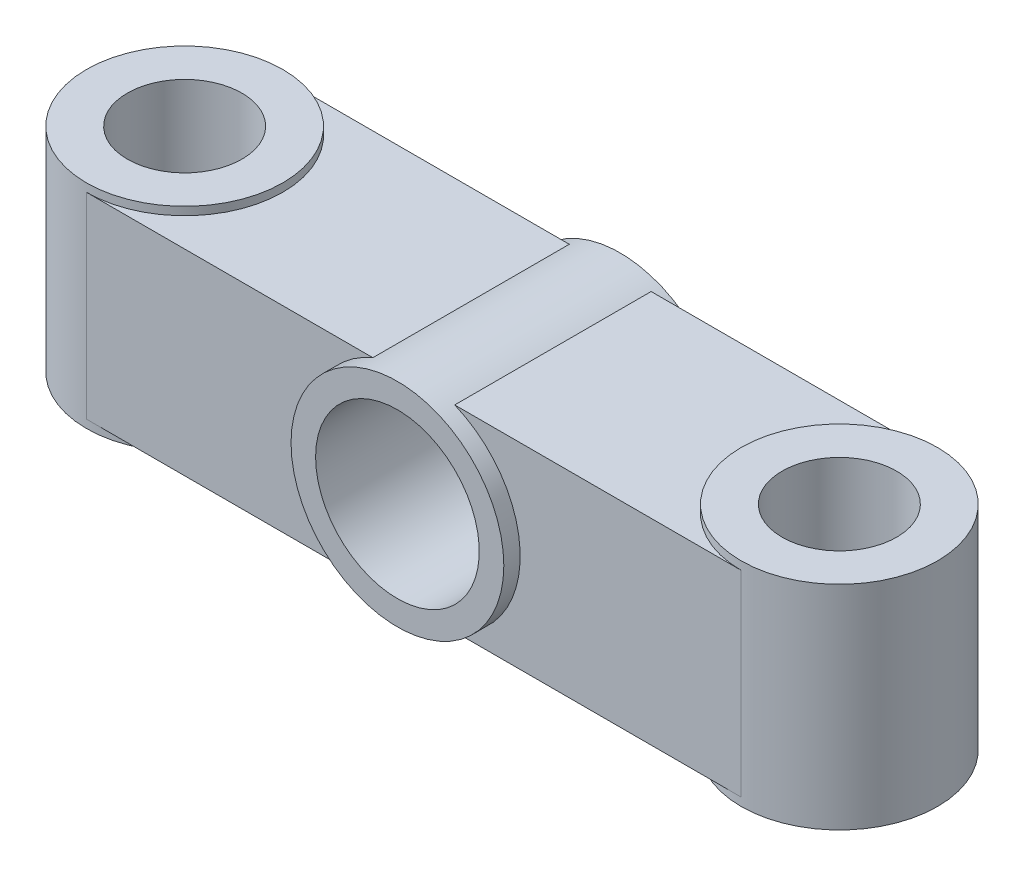
from build123d import *
from build123d.topology import SkipClean

# Parameters (mm, degrees)
EXTRUDE_1_DEPTH     = 3
SKETCH_2_R          = 3
EXTRUDE_2_DEPTH     = 3.25
SKETCH_3_R          = 1.75
CUT_EXTRUDE_3_DEPTH = 6.5
SKETCH_4_R          = 3.25
EXTRUDE_5_DEPTH     = 6.5
EXTRUDE_START       = 0.3
SKETCH_6_R          = 3.25
EXTRUDE_6_DEPTH     = 0.3
SKETCH_7_R          = 2.5
CUT_EXTRUDE_7_DEPTH = 16.02672619


with BuildPart() as part:
    # 草图1 → 拉伸1 (new, symmetric)
    with BuildSketch(Plane(origin=(0, 0, 0), x_dir=(1, 0, 0), z_dir=(0, 1, 0))):
        with BuildLine():
            Line((-10, -3), (10, -3))
            ThreePointArc((10, -3), (13, 0), (10, 3))
            Line((10, 3), (-10, 3))
            ThreePointArc((-10, 3), (-13, 0), (-10, -3))
        make_face()
    extrude(amount=EXTRUDE_1_DEPTH, both=True)

    # 草图2 → 拉伸2 (add, symmetric)
    with SkipClean():  # the faces are left unmerged after this step: merging them gives an invalid solid
        with BuildSketch(Plane(origin=(0, 0, 0), x_dir=(1, 0, 0), z_dir=(0, 1, 0))):
            with Locations(Location((10, 0, 0), (0, 0, 270))):
                Circle(SKETCH_2_R)
            with Locations(Location((-10, 0, 0), (0, 0, 270))):
                Circle(SKETCH_2_R)
        extrude(amount=EXTRUDE_2_DEPTH, both=True)

    # 草图3 → 拉伸3 (cut)
    with SkipClean():  # the faces are left unmerged after this step: merging them gives an invalid solid
        with BuildSketch(Plane(origin=(0, 3.25, 0), x_dir=(1, 0, 0), z_dir=(0, 1, 0))):
            with Locations(Location((-10, 0, 0), (0, 0, 270))):
                Circle(SKETCH_3_R)
            with Locations(Location((10, 0, 0), (0, 0, 270))):
                Circle(SKETCH_3_R)
        extrude(amount=-CUT_EXTRUDE_3_DEPTH, mode=Mode.SUBTRACT)

    # 草图4 → 拉伸5 (add)
    with SkipClean():  # the faces are left unmerged after this step: merging them gives an invalid solid
        with BuildSketch(Plane(origin=(0, 0, -3), x_dir=(-1, 0, 0), z_dir=(0, 0, -1))):
            Circle(SKETCH_4_R)
        extrude(amount=-EXTRUDE_5_DEPTH)

    # 草图6 → 拉伸6 (add)
    with SkipClean():  # the faces are left unmerged after this step: merging them gives an invalid solid
        with BuildSketch(Plane(origin=(0, 0, -3), x_dir=(-1, 0, 0), z_dir=(0, 0, -1)).offset(EXTRUDE_START)):
            Circle(SKETCH_6_R)
        extrude(amount=-EXTRUDE_6_DEPTH)

    # 草图7 → 拉伸7 (cut, through all)
    with SkipClean():  # the faces are left unmerged after this step: merging them gives an invalid solid
        with BuildSketch(Plane(origin=(0, 0, -3.3), x_dir=(-1, 0, 0), z_dir=(0, 0, -1))):
            Circle(SKETCH_7_R)
        extrude(amount=-CUT_EXTRUDE_7_DEPTH, mode=Mode.SUBTRACT)


solid = part.part
